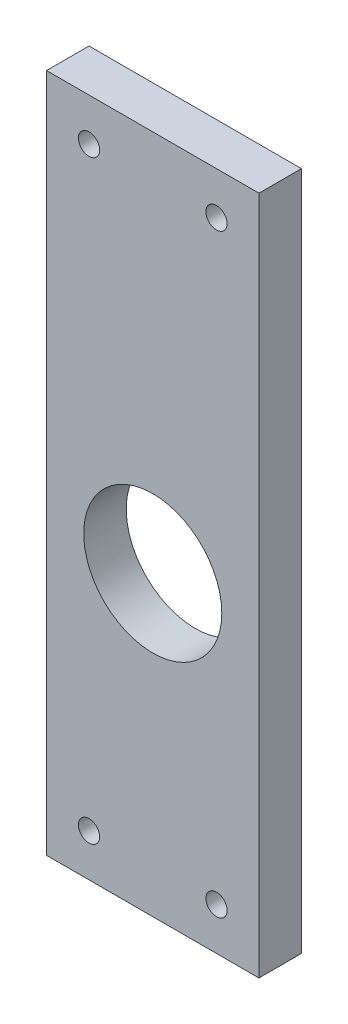
from build123d import *

# Parameters (mm, degrees)
SKETCH1_W            = 63.5
SKETCH1_H            = 203.2
BOSS_EXTRUDE1_DEPTH  = 12.7
SKETCH2_R            = 3.175
CUT_EXTRUDE1_DEPTH   = 108.200338152
LPATTERN1_COUNT      = 2
LPATTERN1_PITCH      = 38.1
LPATTERN1_COUNT_DIR2 = 2
LPATTERN1_PITCH_DIR2 = 177.8
SKETCH3_R            = 20.6375
CUT_EXTRUDE2_DEPTH   = 108.200338152


with BuildPart() as part:
    # Sketch1 → Boss-Extrude1 (new body)
    with BuildSketch(Plane.XY):
        Rectangle(SKETCH1_W, SKETCH1_H)
    extrude(amount=BOSS_EXTRUDE1_DEPTH)

    # Sketch2 → Cut-Extrude1 (cut, through all)
    with BuildSketch(Plane.XY.offset(12.7)):
        with Locations((-19.05, 88.9)):
            Circle(SKETCH2_R)
    cut_extrude1 = extrude(amount=-CUT_EXTRUDE1_DEPTH, mode=Mode.SUBTRACT)

    # LPattern1: Cut-Extrude1 2 × 2
    with Locations(*[(i * LPATTERN1_PITCH, -j * LPATTERN1_PITCH_DIR2, 0) for i in range(LPATTERN1_COUNT) for j in range(LPATTERN1_COUNT_DIR2) if (i, j) != (0, 0)]):
        add(cut_extrude1, mode=Mode.SUBTRACT)

    # Sketch3 → Cut-Extrude2 (cut, through all)
    with BuildSketch(Plane.XY.offset(12.7)):
        with Locations((0, -12.7)):
            Circle(SKETCH3_R)
    extrude(amount=-CUT_EXTRUDE2_DEPTH, mode=Mode.SUBTRACT)


solid = part.part
